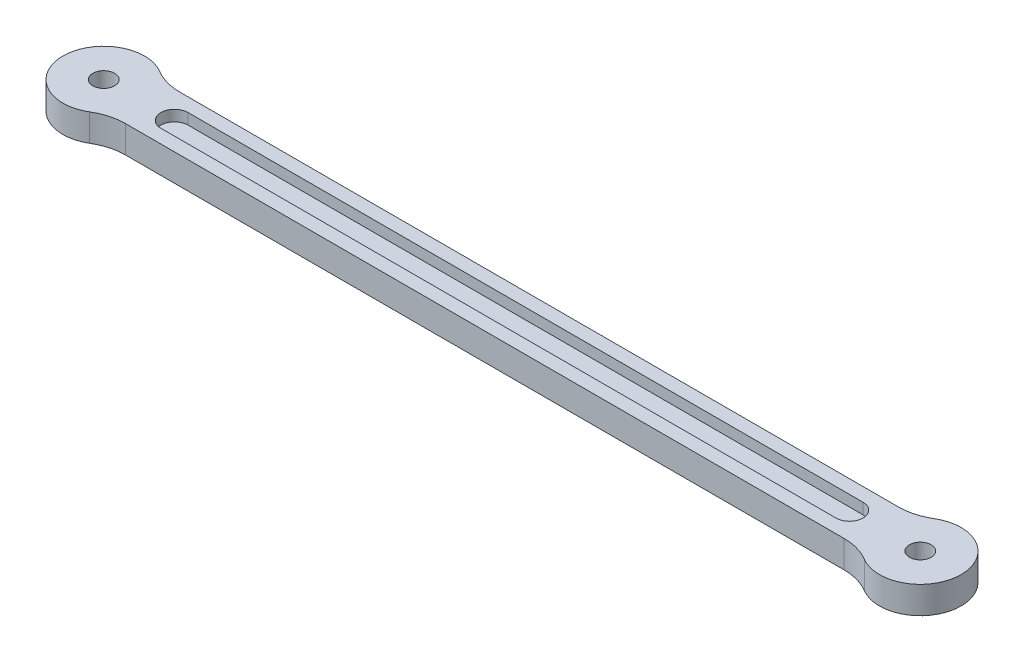
from build123d import *

# Parameters (mm, degrees)
SKETCH1_R           = 2
BOSS_EXTRUDE1_DEPTH = 5
CUT_EXTRUDE1_DEPTH  = 2


with BuildPart() as part:
    # Sketch1 → Boss-Extrude1 (new body)
    with BuildSketch(Plane(origin=(0, 0, 0), x_dir=(1, 0, 0), z_dir=(0, 1, 0))):
        with BuildLine():
            Line((-68.767020688, 12.176966292), (63.205222935, 12.176966292))
            ThreePointArc((63.205222935, 12.176966292), (65.877835354, 12.540725176), (68.356010471, 13.605537721))
            ThreePointArc((68.356010471, 13.605537721), (79.719101124, 7.176966292), (68.356010471, 0.748394864))
            ThreePointArc((68.356010471, 0.748394864), (65.877835354, 1.813207409), (63.205222935, 2.176966292))
            Line((63.205222935, 2.176966292), (-68.767020688, 2.176966292))
            ThreePointArc((-68.767020688, 2.176966292), (-71.439633107, 1.813207409), (-73.917808224, 0.748394864))
            ThreePointArc((-73.917808224, 0.748394864), (-85.280898876, 7.176966292), (-73.917808224, 13.605537721))
            ThreePointArc((-73.917808224, 13.605537721), (-71.439633107, 12.540725176), (-68.767020688, 12.176966292))
        make_face()
        with Locations(Location((-77.780898876, 7.176966292, 0), (0, 0, 270))):
            Circle(SKETCH1_R, mode=Mode.SUBTRACT)
        with Locations(Location((72.219101124, 7.176966292, 0), (0, 0, 270))):
            Circle(SKETCH1_R, mode=Mode.SUBTRACT)
    extrude(amount=BOSS_EXTRUDE1_DEPTH)

    # Sketch3 → Cut-Extrude1 (cut)
    with BuildSketch(Plane(origin=(0, 5, 0), x_dir=(1, 0, 0), z_dir=(0, 1, 0))):
        with BuildLine():
            Line((-64.780898876, 9.676966292), (59.219101124, 9.676966292))
            ThreePointArc((59.219101124, 9.676966292), (61.719101124, 7.176966292), (59.219101124, 4.676966292))
            Line((59.219101124, 4.676966292), (-64.780898876, 4.676966292))
            ThreePointArc((-64.780898876, 4.676966292), (-67.280898876, 7.176966292), (-64.780898876, 9.676966292))
        make_face()
    extrude(amount=-CUT_EXTRUDE1_DEPTH, mode=Mode.SUBTRACT)


solid = part.part
